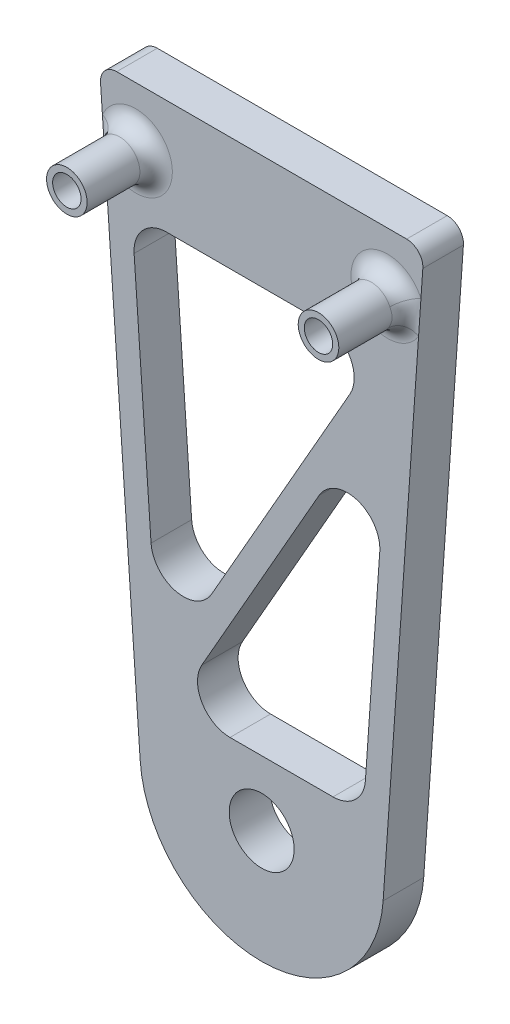
from build123d import *

# Parameters (mm, degrees)
CROQUIS1_R              = 4
CROQUIS1_R_2            = 1.75
SALIENTE_EXTRUIR1_DEPTH = 2.5
CROQUIS1_3_R            = 2.5
CROQUIS1_3_R_2          = 1.75
SALIENTE_EXTRUIR2_DEPTH = 11
REDONDEO1_R             = 2
REDONDEO2_R             = 2
CROQUIS2_R              = 3
CORTAR_EXTRUIR1_DEPTH   = 2
REDONDEO3_R             = 4


with BuildPart() as part:
    # Croquis1 → Saliente-Extruir1 (new, symmetric)
    with BuildSketch(Plane.XY):
        with BuildLine():
            Line((20.001432119, 0), (-20.001432119, 0))
            Line((-20.001432119, 0), (-14.963460754, -72.046347106))
            ThreePointArc((-14.963460754, -72.046347106), (0, -86), (14.963460754, -72.046347106))
            Line((14.963460754, -72.046347106), (20.001432119, 0))
        make_face()
        with Locations((0, -72.046347106)):
            Circle(CROQUIS1_R, mode=Mode.SUBTRACT)
        Polygon((-12.704099543, -61.349956664), (-16.011890152, -14.046347106), (14.28491785, -14.046347106), align=None, mode=Mode.SUBTRACT)
        Polygon((12.515549555, -64.046347106), (-10.788577252, -64.046347106), (15.770666891, -17.496000466), align=None, mode=Mode.SUBTRACT)
        with Locations((-15.5, -7.276347106)):
            Circle(CROQUIS1_R_2, mode=Mode.SUBTRACT)
        with Locations((15.5, -7.276347106)):
            Circle(CROQUIS1_R_2, mode=Mode.SUBTRACT)
    extrude(amount=SALIENTE_EXTRUIR1_DEPTH, both=True)

    # Croquis1<3> → Saliente-Extruir2 (add)
    # profile 1 of 2: a face of its own
    with BuildSketch(Plane.XY):
        with Locations((-15.5, -7.276347106)):
            Circle(CROQUIS1_3_R)
        with Locations((-15.5, -7.276347106)):
            Circle(CROQUIS1_3_R_2, mode=Mode.SUBTRACT)
    # profile 2 of 2: a face of its own
    with BuildSketch(Plane.XY):
        with Locations((15.5, -7.276347106)):
            Circle(CROQUIS1_3_R)
        with Locations((15.5, -7.276347106)):
            Circle(CROQUIS1_3_R_2, mode=Mode.SUBTRACT)
    extrude(amount=SALIENTE_EXTRUIR2_DEPTH)

    # Redondeo1
    redondeo1_edges = [part.edges().sort_by_distance(p)[0] for p in [
        (13, -7.276347106, 2.5),
        (-18, -7.276347106, 2.5),
    ]]
    fillet(redondeo1_edges, radius=REDONDEO1_R)

    # Redondeo2
    redondeo2_edges = [part.edges().sort_by_distance(p)[0] for p in [
        (20.001432119, 0, 0),
        (-20.001432119, 0, 0),
    ]]
    fillet(redondeo2_edges, radius=REDONDEO2_R)

    # Croquis2 → Cortar-Extruir1 (cut)
    with BuildSketch(Plane(origin=(0, 0, -2.5), x_dir=(-1, 0, 0), z_dir=(0, 0, -1))):
        with Locations((-15.5, -7.276347106)):
            Circle(CROQUIS2_R)
        with Locations((15.5, -7.276347106)):
            Circle(CROQUIS2_R)
    extrude(amount=-CORTAR_EXTRUIR1_DEPTH, mode=Mode.SUBTRACT)

    # Redondeo3
    redondeo3_edges = [part.edges().sort_by_distance(p)[0] for p in [
        (-16.011890152, -14.046347106, 0),
        (12.515549555, -64.046347106, 0),
        (-10.788577252, -64.046347106, 0),
        (-12.704099543, -61.349956664, 0),
        (14.28491785, -14.046347106, 0),
        (15.770666891, -17.496000466, 0),
    ]]
    fillet(redondeo3_edges, radius=REDONDEO3_R)


solid = part.part
